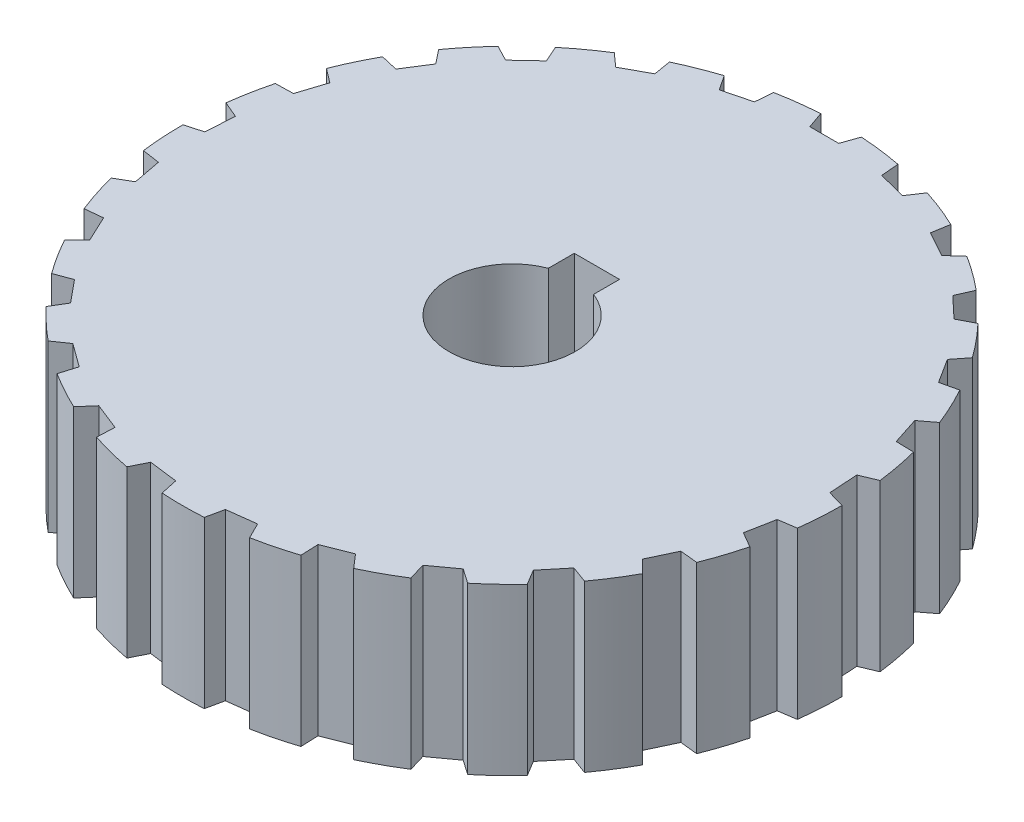
from build123d import *

# Parameters (mm, degrees)
SKETCH5_R           = 37.8968
BOSS_EXTRUDE2_DEPTH = 19.05
CUT_EXTRUDE1_DEPTH  = 22.05
CIRPATTERN1_COUNT   = 25
SKETCH9_R           = 7.25
CUT_EXTRUDE2_DEPTH  = 25.4


with BuildPart() as part:
    # Sketch5 → Boss-Extrude2 (new body)
    with BuildSketch(Plane(origin=(0, 0, 0), x_dir=(1, 0, 0), z_dir=(0, 1, 0))):
        with Locations(Location((0, 0, 0), (0, 0, 90))):
            Circle(SKETCH5_R)
    extrude(amount=BOSS_EXTRUDE2_DEPTH)

    # Sketch8 → Cut-Extrude1 (cut)
    with BuildSketch(Plane(origin=(0, 19.05, 0), x_dir=(1, 0, 0), z_dir=(0, 1, 0))):
        Polygon((0, 37.8968), (2.36, 37.8968), (1.66, 35.8968), (0, 35.8968), (-1.66, 35.8968), (-2.36, 37.8968), align=None)
    cut_extrude1 = extrude(amount=-CUT_EXTRUDE1_DEPTH, mode=Mode.SUBTRACT)

    # CirPattern1: Cut-Extrude1 ×25 about axis
    cirpattern1_axis = Axis((0, 0, 0), (0, 1, 0))
    for i in range(1, CIRPATTERN1_COUNT):
        add(cut_extrude1.rotate(cirpattern1_axis, i * 360 / CIRPATTERN1_COUNT), mode=Mode.SUBTRACT)

    # Sketch9 → Cut-Extrude2 (cut)
    with BuildSketch(Plane(origin=(0, 19.05, 0), x_dir=(1, 0, 0), z_dir=(0, 1, 0))):
        Circle(SKETCH9_R)
        Polygon((2.6, 9.75), (2.6, 7.25), (0, 7.25), (-2.6, 7.25), (-2.6, 9.75), align=None)
        with BuildLine():
            ThreePointArc((-2.6, 6.767754428), (-1.32217253, 7.128419166), (0, 7.25))
            Line((0, 7.25), (-2.6, 7.25))
            Line((-2.6, 7.25), (-2.6, 6.767754428))
        make_face()
        with BuildLine():
            Line((2.6, 7.25), (0, 7.25))
            ThreePointArc((0, 7.25), (1.32217253, 7.128419166), (2.6, 6.767754428))
            Line((2.6, 6.767754428), (2.6, 7.25))
        make_face()
    extrude(amount=-CUT_EXTRUDE2_DEPTH, mode=Mode.SUBTRACT)


solid = part.part
